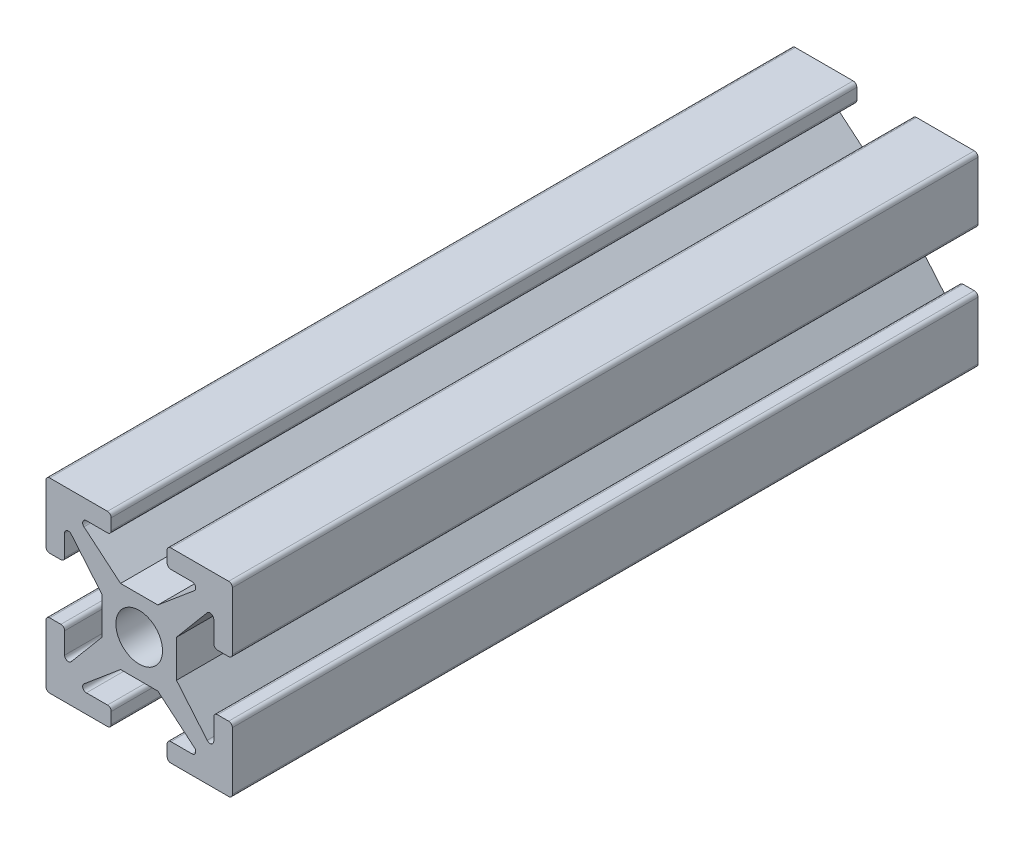
from build123d import *

# Parameters (mm, degrees)
SKETCH1_R           = 1.25
BOSS_EXTRUDE1_DEPTH = 40


with BuildPart() as part:
    # Sketch1 → Boss-Extrude1 (new body)
    with BuildSketch(Plane.XY):
        with BuildLine():
            Line((-4.8, 5), (-1.7, 5))
            ThreePointArc((-1.7, 5), (-1.558578644, 4.941421356), (-1.5, 4.8))
            Line((-1.5, 4.8), (-1.5, 4.2))
            ThreePointArc((-1.5, 4.2), (-1.558578644, 4.058578644), (-1.7, 4))
            Line((-1.7, 4), (-2.834011701, 4))
            ThreePointArc((-2.834011701, 4), (-3.021950225, 3.868404029), (-2.962569223, 3.646791111))
            Line((-2.962569223, 3.646791111), (-1, 2))
            Line((-1, 2), (1, 2))
            Line((1, 2), (2.962569223, 3.646791111))
            ThreePointArc((2.962569223, 3.646791111), (3.021950225, 3.868404029), (2.834011701, 4))
            Line((2.834011701, 4), (1.7, 4))
            ThreePointArc((1.7, 4), (1.558578644, 4.058578644), (1.5, 4.2))
            Line((1.5, 4.2), (1.5, 4.8))
            ThreePointArc((1.5, 4.8), (1.558578644, 4.941421356), (1.7, 5))
            Line((1.7, 5), (4.8, 5))
            ThreePointArc((4.8, 5), (4.941421356, 4.941421356), (5, 4.8))
            Line((5, 4.8), (5, 1.7))
            ThreePointArc((5, 1.7), (4.941421356, 1.558578644), (4.8, 1.5))
            Line((4.8, 1.5), (4.2, 1.5))
            ThreePointArc((4.2, 1.5), (4.058578644, 1.558578644), (4, 1.7))
            Line((4, 1.7), (4, 2.834011701))
            ThreePointArc((4, 2.834011701), (3.868404029, 3.021950225), (3.646791111, 2.962569223))
            Line((3.646791111, 2.962569223), (2, 1))
            Line((2, 1), (2, -1))
            Line((2, -1), (3.646791111, -2.962569223))
            ThreePointArc((3.646791111, -2.962569223), (3.868404029, -3.021950225), (4, -2.834011701))
            Line((4, -2.834011701), (4, -1.7))
            ThreePointArc((4, -1.7), (4.058578644, -1.558578644), (4.2, -1.5))
            Line((4.2, -1.5), (4.8, -1.5))
            ThreePointArc((4.8, -1.5), (4.941421356, -1.558578644), (5, -1.7))
            Line((5, -1.7), (5, -4.8))
            ThreePointArc((5, -4.8), (4.941421356, -4.941421356), (4.8, -5))
            Line((4.8, -5), (1.7, -5))
            ThreePointArc((1.7, -5), (1.558578644, -4.941421356), (1.5, -4.8))
            Line((1.5, -4.8), (1.5, -4.2))
            ThreePointArc((1.5, -4.2), (1.558578644, -4.058578644), (1.7, -4))
            Line((1.7, -4), (2.834011701, -4))
            ThreePointArc((2.834011701, -4), (3.021950225, -3.868404029), (2.962569223, -3.646791111))
            Line((2.962569223, -3.646791111), (1, -2))
            Line((1, -2), (-1, -2))
            Line((-1, -2), (-2.962569223, -3.646791111))
            ThreePointArc((-2.962569223, -3.646791111), (-3.021950225, -3.868404029), (-2.834011701, -4))
            Line((-2.834011701, -4), (-1.7, -4))
            ThreePointArc((-1.7, -4), (-1.558578644, -4.058578644), (-1.5, -4.2))
            Line((-1.5, -4.2), (-1.5, -4.8))
            ThreePointArc((-1.5, -4.8), (-1.558578644, -4.941421356), (-1.7, -5))
            Line((-1.7, -5), (-4.8, -5))
            ThreePointArc((-4.8, -5), (-4.941421356, -4.941421356), (-5, -4.8))
            Line((-5, -4.8), (-5, -1.7))
            ThreePointArc((-5, -1.7), (-4.941421356, -1.558578644), (-4.8, -1.5))
            Line((-4.8, -1.5), (-4.2, -1.5))
            ThreePointArc((-4.2, -1.5), (-4.058578644, -1.558578644), (-4, -1.7))
            Line((-4, -1.7), (-4, -2.834011701))
            ThreePointArc((-4, -2.834011701), (-3.868404029, -3.021950225), (-3.646791111, -2.962569223))
            Line((-3.646791111, -2.962569223), (-2, -1))
            Line((-2, -1), (-2, 1))
            Line((-2, 1), (-3.646791111, 2.962569223))
            ThreePointArc((-3.646791111, 2.962569223), (-3.868404029, 3.021950225), (-4, 2.834011701))
            Line((-4, 2.834011701), (-4, 1.7))
            ThreePointArc((-4, 1.7), (-4.058578644, 1.558578644), (-4.2, 1.5))
            Line((-4.2, 1.5), (-4.8, 1.5))
            ThreePointArc((-4.8, 1.5), (-4.941421356, 1.558578644), (-5, 1.7))
            Line((-5, 1.7), (-5, 4.8))
            ThreePointArc((-5, 4.8), (-4.941421356, 4.941421356), (-4.8, 5))
        make_face()
        Circle(SKETCH1_R, mode=Mode.SUBTRACT)
    extrude(amount=BOSS_EXTRUDE1_DEPTH)


solid = part.part
